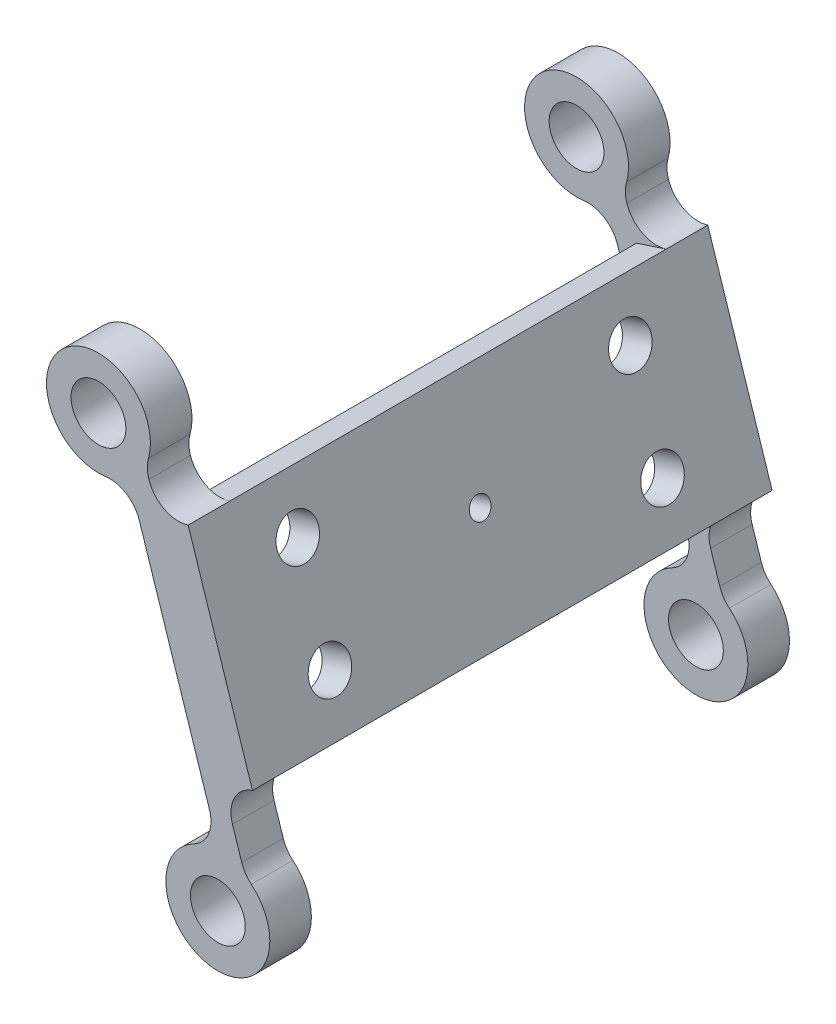
from build123d import *

# Parameters (mm, degrees)
BOSS_EXTRUDE1_DEPTH          = 5
SKETCH6_W                    = 42
SKETCH6_H                    = 20
BOSS_EXTRUDE2_DEPTH          = 3
BOSS_EXTRUDE3_DEPTH          = 4
SKETCH14_W                   = 3
SKETCH14_H                   = 42
BOSS_EXTRUDE4_DEPTH          = 3
SKETCH15_W                   = 3
SKETCH15_H                   = 42
CUT_EXTRUDE1_DEPTH           = 3
BOSS_EXTRUDE5_START          = 4
BOSS_EXTRUDE5_DEPTH          = 4
F_2_0_2_DIAMETER_HOLE1_D     = 2
F_2_0_2_DIAMETER_HOLE1_DEPTH = 13.574856707
F_4_0_4_DIAMETER_HOLE1_D     = 4
F_4_0_4_DIAMETER_HOLE1_DEPTH = 13.574856707
HOLE1_D                      = 5.275
HOLE1_DEPTH                  = 4
HOLE2_D                      = 5.275
F_3_0_3_DIAMETER_HOLE1_D     = 3
F_3_0_3_DIAMETER_HOLE1_DEPTH = 26.254229339
FILLET1_R                    = 3


with BuildPart() as part:
    # Sketch1 → Boss-Extrude1 (new body)
    with BuildSketch(Plane(origin=(-8.342407099, 25.628804584, 0), x_dir=(0.9508916883930938, 0.3095238229037171, 0), z_dir=(0.3095238229037171, -0.9508916883930938, -2.6743365832786e-15))):
        with BuildLine():
            Line((-4.14030738, -30.713017444), (-4.14030738, -23.589232886))
            add(Edge.make_bspline(
                [(-4.14030738, -23.589232886), (-4.220798256, -24.279493403), (-4.802543831, -24.911473889), (-5.885544107, -25.485174345)],
                knots=[0, 0, 0, 0, 1, 1, 1, 1], degree=3))
            ThreePointArc((-5.885544107, -25.485174345), (-7.885544107, -27.485174345), (-5.885544107, -29.485174345))
            add(Edge.make_bspline(
                [(-5.885544107, -29.485174345), (-4.984417634, -29.728649028), (-4.402672059, -30.137930061), (-4.14030738, -30.713017444)],
                knots=[0, 0, 0, 0, 1, 1, 1, 1], degree=3))
        make_face()
    extrude(amount=-BOSS_EXTRUDE1_DEPTH)

    # Sketch6 → Boss-Extrude2 (add)
    with BuildSketch(Plane(origin=(-3.936983875, -1.281523768, 0), x_dir=(0, 0, 1), z_dir=(-0.9508916883930951, -0.30952382290371255, 0))):
        with Locations((-21, 29.452391)):
            Rectangle(SKETCH6_W, SKETCH6_H)
    extrude(amount=-BOSS_EXTRUDE2_DEPTH)

    # Sketch8 → Boss-Extrude3 (add)
    with BuildSketch(Plane.XY):
        with BuildLine():
            Line((-17.397624454, 40.071064625), (-17.077010229, 39.086101986))
            ThreePointArc((-17.077010229, 39.086101986), (-15.584881864, 37.340928389), (-13.295763695, 37.161998389))
            Line((-13.295763695, 37.161998389), (-7.105287237, 18.144164622))
            ThreePointArc((-7.105287237, 18.144164622), (-8.850460834, 16.652036257), (-9.029390833, 14.362918088))
            Line((-9.029390833, 14.362918088), (-7.842362425, 10.716234493))
            ThreePointArc((-7.842362425, 10.716234493), (-11.874437039, 1.653788416), (-10.256851829, 11.439950722))
            Line((-10.256851829, 11.439950722), (-18.956793202, 38.167140452))
            ThreePointArc((-18.956793202, 38.167140452), (-25.795005306, 45.357497095), (-17.397624454, 40.071064625))
        make_face()
    extrude(amount=BOSS_EXTRUDE3_DEPTH)

    # Sketch14 → Boss-Extrude4 (add)
    with BuildSketch(Plane(origin=(-6.020978427, 18.497116921, 0), x_dir=(-0.9508916883930951, -0.30952382290371255, 0), z_dir=(0.30952382290371255, -0.9508916883930951, 0))):
        with Locations((2.64030738, 21)):
            Rectangle(SKETCH14_W, SKETCH14_H)
    extrude(amount=BOSS_EXTRUDE4_DEPTH)

    # Sketch15 → Cut-Extrude1 (cut)
    with BuildSketch(Plane(origin=(-5.092406958, 15.644441856, 0), x_dir=(0.9508916883930948, 0.3095238229037141, 0), z_dir=(0.3095238229037141, -0.9508916883930948, 0))):
        with Locations((-2.64030738, -21)):
            Rectangle(SKETCH15_W, SKETCH15_H)
    extrude(amount=-CUT_EXTRUDE1_DEPTH, mode=Mode.SUBTRACT)

    # Sketch22 → Boss-Extrude5 (add)
    with BuildSketch(Plane(origin=(0, 0, -42), x_dir=(-1, 0, 0), z_dir=(0, 0, -1)).offset(BOSS_EXTRUDE5_START)):
        with BuildLine():
            Line((18.956793202, 38.167140452), (10.256851829, 11.439950722))
            ThreePointArc((10.256851829, 11.439950722), (11.874437039, 1.653788416), (7.842362425, 10.716234493))
            Line((7.842362425, 10.716234493), (9.029390833, 14.362918088))
            ThreePointArc((9.029390833, 14.362918088), (8.850460834, 16.652036257), (7.105287237, 18.144164622))
            Line((7.105287237, 18.144164622), (13.295763695, 37.161998389))
            ThreePointArc((13.295763695, 37.161998389), (15.584881864, 37.340928389), (17.077010229, 39.086101986))
            Line((17.077010229, 39.086101986), (17.397624454, 40.071064625))
            ThreePointArc((17.397624454, 40.071064625), (25.795005306, 45.357497095), (18.956793202, 38.167140452))
        make_face()
    extrude(amount=-BOSS_EXTRUDE5_DEPTH)

    # Ø2.0 (2) Diameter Hole1
    with Locations(Plane(origin=(-3.936983875, -1.281523768, 0), x_dir=(0, 0, 1), z_dir=(-0.9508916883930952, -0.30952382290371244, 0))):
        with Locations((-21, 29.452391)):
            Hole(F_2_0_2_DIAMETER_HOLE1_D / 2, depth=F_2_0_2_DIAMETER_HOLE1_DEPTH)

    # Ø4.0 (4) Diameter Hole1
    with Locations(Plane(origin=(-3.936983875, -1.281523768, 0), x_dir=(0, 0, 1), z_dir=(-0.9508916883930952, -0.30952382290371244, 0))):
        with Locations((-5, 24.452391), (-37, 24.452391), (-37, 34.452391), (-5, 34.452391)):
            Hole(F_4_0_4_DIAMETER_HOLE1_D / 2, depth=F_4_0_4_DIAMETER_HOLE1_DEPTH)

    # Hole1
    with Locations(Plane(origin=(0, 0, -46), x_dir=(-1, 0, 0), z_dir=(0, 0, -1))):
        with Locations((10.438845238, 6.44326398), (21.926625837, 42.189589224)):
            Hole(HOLE1_D / 2, depth=HOLE1_DEPTH)

    # Hole2 (through all)
    with Locations(Plane(origin=(0, 0, 0), x_dir=(-1, 0, 0), z_dir=(0, 0, -1))):
        with Locations((10.438845238, 6.44326398), (21.926625837, 42.189589224)):
            Hole(HOLE2_D / 2)

    # Ø3.0 (3) Diameter Hole1
    with Locations(Plane(origin=(-8.342407099, 25.628804584, 0), x_dir=(-0.9508916883930948, -0.3095238229037141, 0), z_dir=(0.3095238229037141, -0.9508916883930948, -2.289498903453547e-15))):
        with Locations((5.885544107, 27.485174345)):
            Hole(F_3_0_3_DIAMETER_HOLE1_D / 2, depth=F_3_0_3_DIAMETER_HOLE1_DEPTH)

    # Fillet1
    fillet1_edges = [part.edges().sort_by_distance(p)[0] for p in [
        (-17.397624454, 40.071064625, 2),
        (-18.956793202, 38.167140452, 2),
        (-10.256851829, 11.439950722, 2),
        (-7.842362425, 10.716234493, 2),
        (-18.956793202, 38.167140452, -44),
        (-17.397624454, 40.071064625, -44),
        (-7.842362425, 10.716234493, -44),
        (-10.256851829, 11.439950722, -44),
    ]]
    fillet(fillet1_edges, radius=FILLET1_R)


solid = part.part
